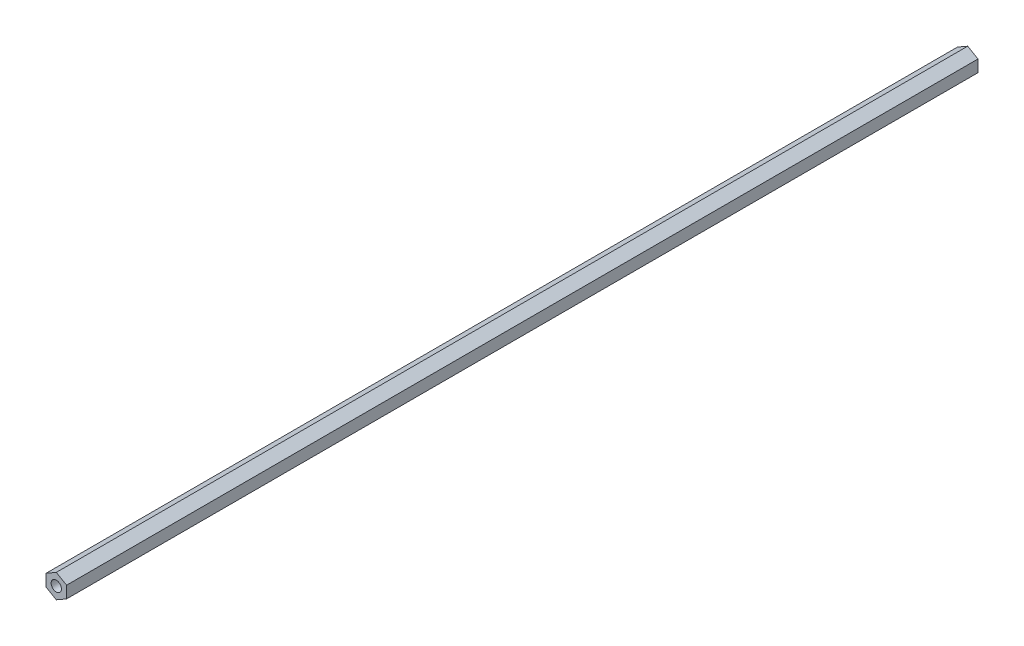
from build123d import *

# Parameters (mm, degrees)
BOSS_EXTRUDE2_DEPTH             = 280.9875
BOSS_EXTRUDE2_DEPTH_BACK        = 280.9875
F_1_4_0_25_DIAMETER_HOLE1_D     = 6.35
F_1_4_0_25_DIAMETER_HOLE1_DEPTH = 25.4
F_1_4_0_25_DIAMETER_HOLE1_TIP   = 1.907732465
F_1_4_0_25_DIAMETER_HOLE2_D     = 6.35
F_1_4_0_25_DIAMETER_HOLE2_DEPTH = 25.4
F_1_4_0_25_DIAMETER_HOLE2_TIP   = 1.907732465


with BuildPart() as part:
    # Sketch3 → Boss-Extrude2 (new, two sides: drawn at the far end of the back side and taken through both)
    with BuildSketch(Plane.XY.offset(-BOSS_EXTRUDE2_DEPTH_BACK)):
        Polygon((-6.35, -3.666174209), (0, -7.332348419), (6.35, -3.666174209), (6.35, 3.666174209), (0, 7.332348419), (-6.35, 3.666174209), align=None)
    extrude(amount=BOSS_EXTRUDE2_DEPTH + BOSS_EXTRUDE2_DEPTH_BACK)

    # 1/4 (0.25) Diameter Hole1
    with Locations(Plane.XY.offset(280.9875)):
        with Locations((0, 0)):
            Hole(F_1_4_0_25_DIAMETER_HOLE1_D / 2, depth=F_1_4_0_25_DIAMETER_HOLE1_DEPTH)
            with Locations((0, 0, -(F_1_4_0_25_DIAMETER_HOLE1_DEPTH + F_1_4_0_25_DIAMETER_HOLE1_TIP / 2))):  # 118° drill point
                Cone(0, F_1_4_0_25_DIAMETER_HOLE1_D / 2, F_1_4_0_25_DIAMETER_HOLE1_TIP, mode=Mode.SUBTRACT)

    # 1/4 (0.25) Diameter Hole2
    with Locations(Plane(origin=(0, 0, -280.9875), x_dir=(-1, 0, 0), z_dir=(0, 0, -1))):
        with Locations((0, 0)):
            Hole(F_1_4_0_25_DIAMETER_HOLE2_D / 2, depth=F_1_4_0_25_DIAMETER_HOLE2_DEPTH)
            with Locations((0, 0, -(F_1_4_0_25_DIAMETER_HOLE2_DEPTH + F_1_4_0_25_DIAMETER_HOLE2_TIP / 2))):  # 118° drill point
                Cone(0, F_1_4_0_25_DIAMETER_HOLE2_D / 2, F_1_4_0_25_DIAMETER_HOLE2_TIP, mode=Mode.SUBTRACT)


solid = part.part
